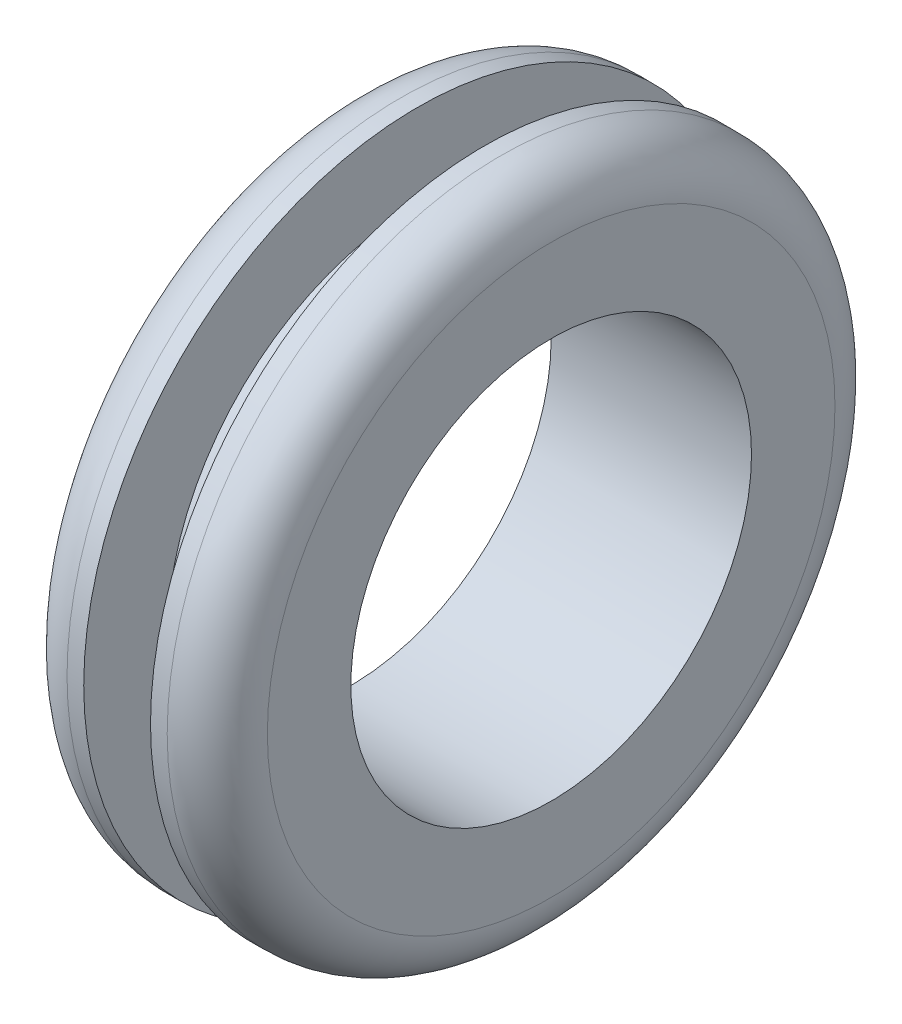
from build123d import *

# Parameters (mm, degrees)
SKETCH_2_R          = 6
CUT_EXTRUDE_1_DEPTH = 6
FILLET_1_R          = 1.5


with BuildPart() as part:
    # Эскиз1 → Повернуть1 (revolve)
    with BuildSketch(Plane.XY, mode=Mode.PRIVATE) as revolve_1_sk:
        Polygon((-17.967397807, 0), (-11.967397807, 0), (-11.967397807, 10), (-13.967397807, 10), (-13.967397807, 7.5), (-15.967397807, 7.5), (-15.967397807, 10), (-17.967397807, 10), align=None)
    revolve(revolve_1_sk.sketch.rotate(Axis((-29.10997009, 0, 0), (1, 0, 0)), 90), axis=Axis((-29.10997009, 0, 0), (1, 0, 0)))

    # Эскиз2 → Вырез-Вытянуть1 (cut)
    with BuildSketch(Plane(origin=(-11.967397807, 0, 0), x_dir=(0, 0, -1), z_dir=(1, 0, 0))):
        Circle(SKETCH_2_R)
    extrude(amount=-CUT_EXTRUDE_1_DEPTH, mode=Mode.SUBTRACT)

    # Скругление1
    fillet_1_edges = [part.edges().sort_by_distance(p)[0] for p in [
        (-11.967397807, 0, -10),
        (-17.967397807, 0, -10),
    ]]
    fillet(fillet_1_edges, radius=FILLET_1_R)


solid = part.part
